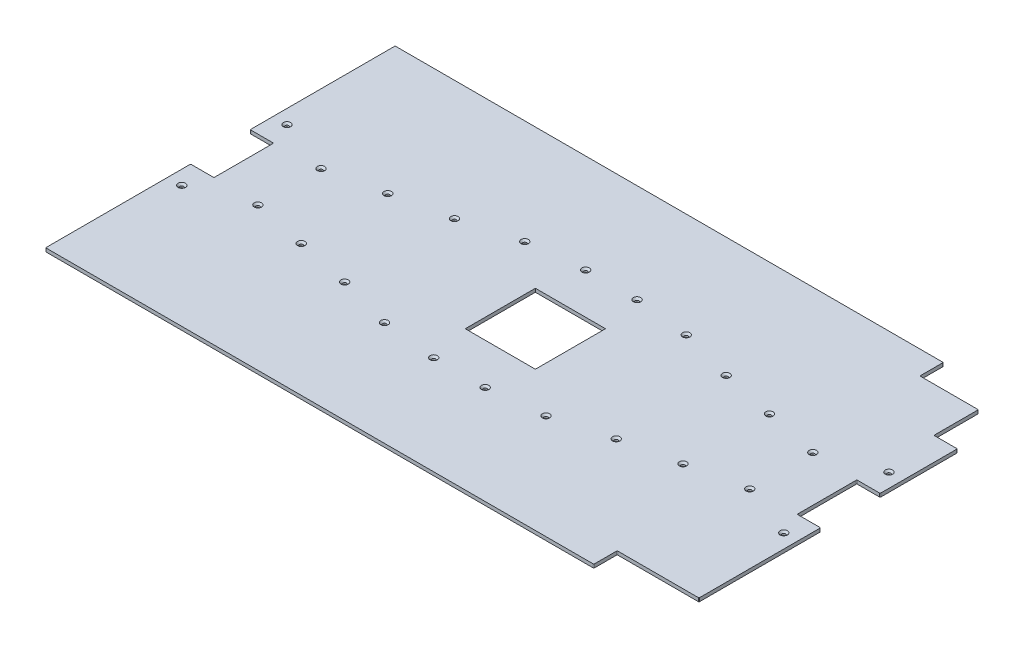
from build123d import *

# Parameters (mm, degrees)
SKETCH1_W                                      = 539
SKETCH1_H                                      = 299
BOSS_EXTRUDE1_DEPTH                            = 3
SKETCH2_W                                      = 20
SKETCH2_H                                      = 51
CUT_EXTRUDE1_DEPTH                             = 309.203666429
CSK_FOR_M3_FLAT_HEAD_MACHINE_SCREW1_AT_2_COUNT = 2
CSK_FOR_M3_FLAT_HEAD_MACHINE_SCREW1_AT_2_PITCH = 50.429256866
CSK_FOR_M3_FLAT_HEAD_MACHINE_SCREW1_AT_3_COUNT = 2
CSK_FOR_M3_FLAT_HEAD_MACHINE_SCREW1_AT_3_PITCH = 94.539771311
CSK_FOR_M3_FLAT_HEAD_MACHINE_SCREW1_AT_4_COUNT = 2
CSK_FOR_M3_FLAT_HEAD_MACHINE_SCREW1_AT_4_PITCH = 141.314201671
CSK_FOR_M3_FLAT_HEAD_MACHINE_SCREW1_AT_5_COUNT = 2
CSK_FOR_M3_FLAT_HEAD_MACHINE_SCREW1_AT_5_PITCH = 188.996190438
CSK_FOR_M3_FLAT_HEAD_MACHINE_SCREW1_AT_6_COUNT = 2
CSK_FOR_M3_FLAT_HEAD_MACHINE_SCREW1_AT_6_PITCH = 236.347731108
CUT_EXTRUDE3_DEPTH                             = 309.203666429
CUT_EXTRUDE3_DEPTH_BACK                        = 309.203666429
SKETCH6_W                                      = 70
SKETCH6_H                                      = 20
SKETCH9_W                                      = 60
SKETCH9_H                                      = 60
CUT_EXTRUDE4_DEPTH                             = 309.203666429
FILLET1_R                                      = 0.5


with BuildPart() as part:
    # Sketch1 → Boss-Extrude1 (new body)
    with BuildSketch(Plane(origin=(0, 0, 0), x_dir=(1, 0, 0), z_dir=(0, 1, 0))):
        Rectangle(SKETCH1_W, SKETCH1_H)
    extrude(amount=BOSS_EXTRUDE1_DEPTH)

    # Sketch2 → Cut-Extrude1 (cut, through all)
    with BuildSketch(Plane(origin=(0, 3, 0), x_dir=(1, 0, 0), z_dir=(0, 1, 0))):
        with Locations((-259.5, 0)):
            Rectangle(SKETCH2_W, SKETCH2_H)
    cut_extrude1 = extrude(amount=-CUT_EXTRUDE1_DEPTH, mode=Mode.SUBTRACT)

    # Mirror1: Cut-Extrude1 across plane
    add(cut_extrude1.mirror(Plane(origin=(0, 0, 0), x_dir=(0, 0, 1), z_dir=(1, 0, 0))), mode=Mode.SUBTRACT)

    # Sketch4 → CSK for M3 Flat Head Machine Screw1 (revolve, cut)
    with BuildSketch(Plane(origin=(-257.5, 3, 45), x_dir=(0, 0, 1), z_dir=(1, 0, 0))):
        Polygon((0, 0), (0, 3), (1.6, 3), (1.6, 1.55), (3.15, 0), align=None)
    csk_for_m3_flat_head_machine_screw1 = revolve(axis=Axis((-257.5, 9.35, 45), (0, -1, 0)), mode=Mode.SUBTRACT)

    # CSK for M3 Flat Head Machine Screw1 at 2: CSK for M3 Flat Head Machine Screw1 ×2
    with Locations(*[Vector(0.9339816393782528, 0, -0.357321000368452) * (i * CSK_FOR_M3_FLAT_HEAD_MACHINE_SCREW1_AT_2_PITCH) for i in range(1, CSK_FOR_M3_FLAT_HEAD_MACHINE_SCREW1_AT_2_COUNT)]):
        add(csk_for_m3_flat_head_machine_screw1, mode=Mode.SUBTRACT)

    # CSK for M3 Flat Head Machine Screw1 at 3: CSK for M3 Flat Head Machine Screw1 ×2
    with Locations(*[Vector(0.9964060489398768, 0, -0.0847052869425741) * (i * CSK_FOR_M3_FLAT_HEAD_MACHINE_SCREW1_AT_3_PITCH) for i in range(1, CSK_FOR_M3_FLAT_HEAD_MACHINE_SCREW1_AT_3_COUNT)]):
        add(csk_for_m3_flat_head_machine_screw1, mode=Mode.SUBTRACT)

    # CSK for M3 Flat Head Machine Screw1 at 4: CSK for M3 Flat Head Machine Screw1 ×2
    with Locations(*[Vector(0.9998995028746508, 0, 0.01417688791753526) * (i * CSK_FOR_M3_FLAT_HEAD_MACHINE_SCREW1_AT_4_PITCH) for i in range(1, CSK_FOR_M3_FLAT_HEAD_MACHINE_SCREW1_AT_4_COUNT)]):
        add(csk_for_m3_flat_head_machine_screw1, mode=Mode.SUBTRACT)

    # CSK for M3 Flat Head Machine Screw1 at 5: CSK for M3 Flat Head Machine Screw1 ×2
    with Locations(*[Vector(0.9968454896555541, 0, 0.07936667911270336) * (i * CSK_FOR_M3_FLAT_HEAD_MACHINE_SCREW1_AT_5_PITCH) for i in range(1, CSK_FOR_M3_FLAT_HEAD_MACHINE_SCREW1_AT_5_COUNT)]):
        add(csk_for_m3_flat_head_machine_screw1, mode=Mode.SUBTRACT)

    # CSK for M3 Flat Head Machine Screw1 at 6: CSK for M3 Flat Head Machine Screw1 ×2
    with Locations(*[Vector(0.9964132039506463, 0, 0.08462107889177463) * (i * CSK_FOR_M3_FLAT_HEAD_MACHINE_SCREW1_AT_6_PITCH) for i in range(1, CSK_FOR_M3_FLAT_HEAD_MACHINE_SCREW1_AT_6_COUNT)]):
        add(csk_for_m3_flat_head_machine_screw1, mode=Mode.SUBTRACT)

    # Sketch6 → Cut-Extrude3 (cut, two sides: drawn at the far end of the back side and taken through both)
    with BuildSketch(Plane(origin=(0, 3, 0), x_dir=(1, 0, 0), z_dir=(0, 1, 0)).offset(-CUT_EXTRUDE3_DEPTH_BACK)):
        Polygon((199.5, 149.5), (199.5, 129.5), (249.5, 129.5), (249.5, 91.5), (269.5, 91.5), (269.5, 149.5), align=None)
        with Locations((234.5, -139.5)):
            Rectangle(SKETCH6_W, SKETCH6_H)
    extrude(amount=CUT_EXTRUDE3_DEPTH + CUT_EXTRUDE3_DEPTH_BACK, mode=Mode.SUBTRACT)

    # Mirror2: CSK for M3 Flat Head Machine Screw1 across plane
    add(csk_for_m3_flat_head_machine_screw1.mirror(Plane(origin=(0, 0, 0), x_dir=(0, 0, 1), z_dir=(1, 0, 0))), mode=Mode.SUBTRACT)

    # Mirror2 copy 1 sketch → Mirror2 copy 1 (revolve, cut)
    with BuildSketch(Plane(origin=(210.4, 3, 26.980567489), x_dir=(0, 0, 1), z_dir=(-1, 0, 0))):
        Polygon((0, 0), (0, -3), (1.6, -3), (1.6, -1.55), (3.15, 0), align=None)
    revolve(axis=Axis((210.4, 9.35, 26.980567489), (0, 1, 0)), mode=Mode.SUBTRACT)

    # Mirror2 copy 2 sketch → Mirror2 copy 2 (revolve, cut)
    with BuildSketch(Plane(origin=(163.3, 3, 36.991981544), x_dir=(0, 0, 1), z_dir=(-1, 0, 0))):
        Polygon((0, 0), (0, -3), (1.6, -3), (1.6, -1.55), (3.15, 0), align=None)
    revolve(axis=Axis((163.3, 9.35, 36.991981544), (0, 1, 0)), mode=Mode.SUBTRACT)

    # Mirror2 copy 3 sketch → Mirror2 copy 3 (revolve, cut)
    with BuildSketch(Plane(origin=(116.2, 3, 47.003395598), x_dir=(0, 0, 1), z_dir=(-1, 0, 0))):
        Polygon((0, 0), (0, -3), (1.6, -3), (1.6, -1.55), (3.15, 0), align=None)
    revolve(axis=Axis((116.2, 9.35, 47.003395598), (0, 1, 0)), mode=Mode.SUBTRACT)

    # Mirror2 copy 4 sketch → Mirror2 copy 4 (revolve, cut)
    with BuildSketch(Plane(origin=(69.1, 3, 60), x_dir=(0, 0, 1), z_dir=(-1, 0, 0))):
        Polygon((0, 0), (0, -3), (1.6, -3), (1.6, -1.55), (3.15, 0), align=None)
    revolve(axis=Axis((69.1, 9.35, 60), (0, 1, 0)), mode=Mode.SUBTRACT)

    # Mirror2 copy 5 sketch → Mirror2 copy 5 (revolve, cut)
    with BuildSketch(Plane(origin=(22, 3, 65), x_dir=(0, 0, 1), z_dir=(-1, 0, 0))):
        Polygon((0, 0), (0, -3), (1.6, -3), (1.6, -1.55), (3.15, 0), align=None)
    revolve(axis=Axis((22, 9.35, 65), (0, 1, 0)), mode=Mode.SUBTRACT)

    # Mirror3: CSK for M3 Flat Head Machine Screw1 across plane
    add(csk_for_m3_flat_head_machine_screw1.mirror(Plane.XY), mode=Mode.SUBTRACT)

    # Mirror3 copy 1 sketch → Mirror3 copy 1 (revolve, cut)
    with BuildSketch(Plane(origin=(-210.4, 3, -26.980567489), x_dir=(0, 0, -1), z_dir=(1, 0, 0))):
        Polygon((0, 0), (0, -3), (1.6, -3), (1.6, -1.55), (3.15, 0), align=None)
    revolve(axis=Axis((-210.4, 9.35, -26.980567489), (0, 1, 0)), mode=Mode.SUBTRACT)

    # Mirror3 copy 2 sketch → Mirror3 copy 2 (revolve, cut)
    with BuildSketch(Plane(origin=(-163.3, 3, -36.991981544), x_dir=(0, 0, -1), z_dir=(1, 0, 0))):
        Polygon((0, 0), (0, -3), (1.6, -3), (1.6, -1.55), (3.15, 0), align=None)
    revolve(axis=Axis((-163.3, 9.35, -36.991981544), (0, 1, 0)), mode=Mode.SUBTRACT)

    # Mirror3 copy 3 sketch → Mirror3 copy 3 (revolve, cut)
    with BuildSketch(Plane(origin=(-116.2, 3, -47.003395598), x_dir=(0, 0, -1), z_dir=(1, 0, 0))):
        Polygon((0, 0), (0, -3), (1.6, -3), (1.6, -1.55), (3.15, 0), align=None)
    revolve(axis=Axis((-116.2, 9.35, -47.003395598), (0, 1, 0)), mode=Mode.SUBTRACT)

    # Mirror3 copy 4 sketch → Mirror3 copy 4 (revolve, cut)
    with BuildSketch(Plane(origin=(-69.1, 3, -60), x_dir=(0, 0, -1), z_dir=(1, 0, 0))):
        Polygon((0, 0), (0, -3), (1.6, -3), (1.6, -1.55), (3.15, 0), align=None)
    revolve(axis=Axis((-69.1, 9.35, -60), (0, 1, 0)), mode=Mode.SUBTRACT)

    # Mirror3 copy 5 sketch → Mirror3 copy 5 (revolve, cut)
    with BuildSketch(Plane(origin=(-22, 3, -65), x_dir=(0, 0, -1), z_dir=(1, 0, 0))):
        Polygon((0, 0), (0, -3), (1.6, -3), (1.6, -1.55), (3.15, 0), align=None)
    revolve(axis=Axis((-22, 9.35, -65), (0, 1, 0)), mode=Mode.SUBTRACT)

    # Mirror3 copy 6 sketch → Mirror3 copy 6 (revolve, cut)
    with BuildSketch(Plane(origin=(257.5, 3, -45), x_dir=(0, 0, -1), z_dir=(-1, 0, 0))):
        Polygon((0, 0), (0, 3), (1.6, 3), (1.6, 1.55), (3.15, 0), align=None)
    revolve(axis=Axis((257.5, 9.35, -45), (0, -1, 0)), mode=Mode.SUBTRACT)

    # Mirror3 copy 7 sketch → Mirror3 copy 7 (revolve, cut)
    with BuildSketch(Plane(origin=(210.4, 3, -26.980567489), x_dir=(0, 0, -1), z_dir=(-1, 0, 0))):
        Polygon((0, 0), (0, 3), (1.6, 3), (1.6, 1.55), (3.15, 0), align=None)
    revolve(axis=Axis((210.4, 9.35, -26.980567489), (0, -1, 0)), mode=Mode.SUBTRACT)

    # Mirror3 copy 8 sketch → Mirror3 copy 8 (revolve, cut)
    with BuildSketch(Plane(origin=(163.3, 3, -36.991981544), x_dir=(0, 0, -1), z_dir=(-1, 0, 0))):
        Polygon((0, 0), (0, 3), (1.6, 3), (1.6, 1.55), (3.15, 0), align=None)
    revolve(axis=Axis((163.3, 9.35, -36.991981544), (0, -1, 0)), mode=Mode.SUBTRACT)

    # Mirror3 copy 9 sketch → Mirror3 copy 9 (revolve, cut)
    with BuildSketch(Plane(origin=(116.2, 3, -47.003395598), x_dir=(0, 0, -1), z_dir=(-1, 0, 0))):
        Polygon((0, 0), (0, 3), (1.6, 3), (1.6, 1.55), (3.15, 0), align=None)
    revolve(axis=Axis((116.2, 9.35, -47.003395598), (0, -1, 0)), mode=Mode.SUBTRACT)

    # Mirror3 copy 10 sketch → Mirror3 copy 10 (revolve, cut)
    with BuildSketch(Plane(origin=(69.1, 3, -60), x_dir=(0, 0, -1), z_dir=(-1, 0, 0))):
        Polygon((0, 0), (0, 3), (1.6, 3), (1.6, 1.55), (3.15, 0), align=None)
    revolve(axis=Axis((69.1, 9.35, -60), (0, -1, 0)), mode=Mode.SUBTRACT)

    # Mirror3 copy 11 sketch → Mirror3 copy 11 (revolve, cut)
    with BuildSketch(Plane(origin=(22, 3, -65), x_dir=(0, 0, -1), z_dir=(-1, 0, 0))):
        Polygon((0, 0), (0, 3), (1.6, 3), (1.6, 1.55), (3.15, 0), align=None)
    revolve(axis=Axis((22, 9.35, -65), (0, -1, 0)), mode=Mode.SUBTRACT)

    # Sketch9 → Cut-Extrude4 (cut, through all)
    with BuildSketch(Plane(origin=(0, 3, 0), x_dir=(1, 0, 0), z_dir=(0, 1, 0))):
        Rectangle(SKETCH9_W, SKETCH9_H)
    extrude(amount=-CUT_EXTRUDE4_DEPTH, mode=Mode.SUBTRACT)

    # Fillet1
    fillet1_edges = [part.edges().sort_by_distance(p)[0] for p in [
        (269.5, 1.5, 129.5),
        (199.5, 1.5, 149.5),
        (199.5, 1.5, 129.5),
        (-269.5, 1.5, 25.5),
        (-269.5, 1.5, -25.5),
        (-249.5, 1.5, -25.5),
        (-249.5, 1.5, 25.5),
        (269.5, 1.5, -25.5),
        (269.5, 1.5, 25.5),
        (249.5, 1.5, 25.5),
        (249.5, 1.5, -25.5),
        (-269.5, 1.5, -149.5),
        (-269.5, 1.5, 149.5),
        (199.5, 1.5, -149.5),
        (269.5, 1.5, -91.5),
        (249.5, 1.5, -91.5),
        (249.5, 1.5, -129.5),
        (199.5, 1.5, -129.5),
    ]]
    fillet(fillet1_edges, radius=FILLET1_R)


solid = part.part
